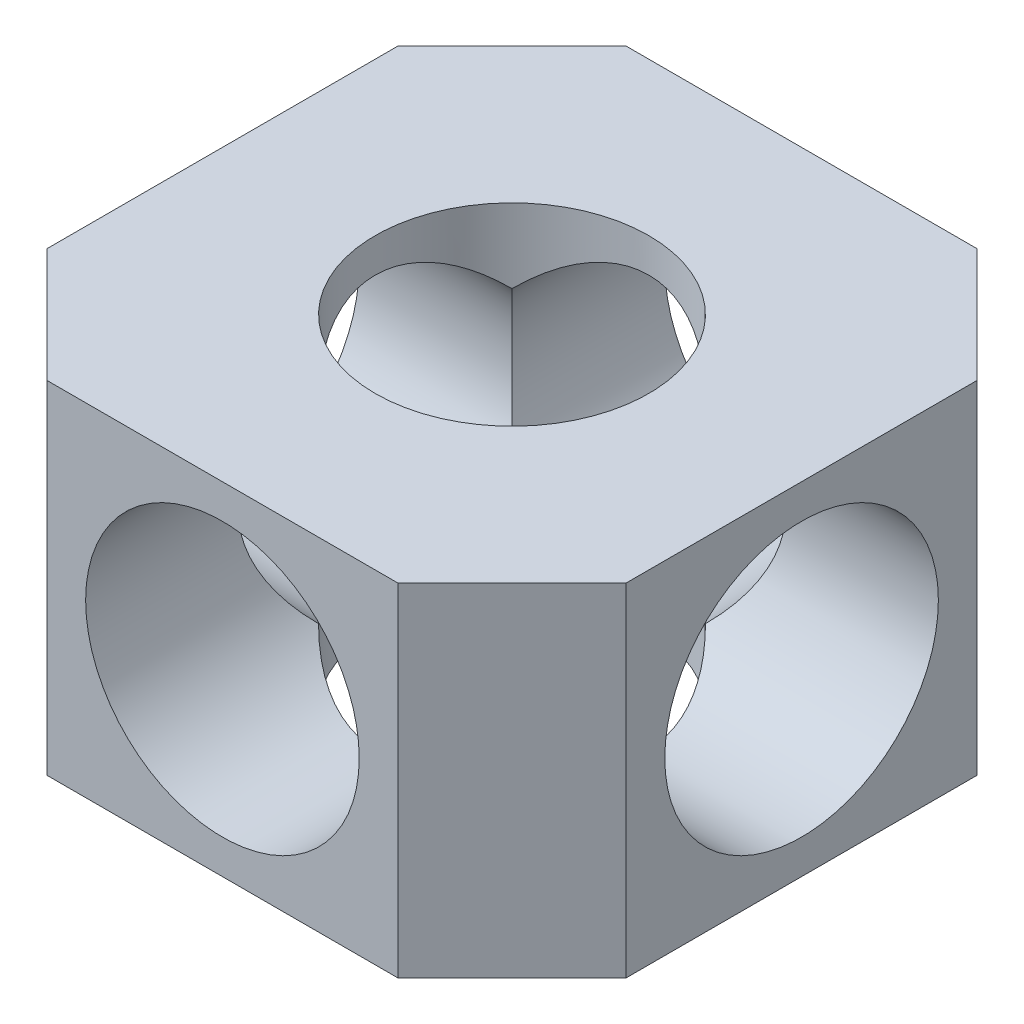
from build123d import *

# Parameters (mm, degrees)
SKETCH2_W               = 25.4
SKETCH2_H               = 25.4
BOSS_EXTRUDE1_DEPTH     = 7.5
CHAMFER1_SIZE           = 5
SKETCH3_R               = 6
CUT_EXTRUDE1_DEPTH      = 24.400427347
CUT_EXTRUDE2_REACH      = 31.372
CUT_EXTRUDE2_END_RADIUS = 6
SKETCH4_R               = 6
CIRPATTERN1_COUNT       = 4


with BuildPart() as part:
    # Sketch2 → Boss-Extrude1 (new, symmetric)
    with BuildSketch(Plane(origin=(0, 0, 0), x_dir=(1, 0, 0), z_dir=(0, 1, 0))):
        Rectangle(SKETCH2_W, SKETCH2_H)
    extrude(amount=BOSS_EXTRUDE1_DEPTH, both=True)

    # Chamfer1
    chamfer1_edges = [part.edges().sort_by_distance(p)[0] for p in [
        (12.7, 0, 12.7),
        (-12.7, 0, 12.7),
        (-12.7, 0, -12.7),
        (12.7, 0, -12.7),
    ]]
    chamfer(chamfer1_edges, length=CHAMFER1_SIZE)

    # Sketch3 → Cut-Extrude1 (cut, through all)
    with BuildSketch(Plane(origin=(0, 7.5, 0), x_dir=(1, 0, 0), z_dir=(0, 1, 0))):
        with Locations(Location((0, 0, 0), (0, 0, 270))):
            Circle(SKETCH3_R)
    extrude(amount=-CUT_EXTRUDE1_DEPTH, mode=Mode.SUBTRACT)

    # Cut-Extrude2: up to this cylinder (the profile starts outside it)
    cut_extrude2_end = Plane(origin=(0, 0, 0), z_dir=(0, 1, 0)) * Cylinder(CUT_EXTRUDE2_END_RADIUS, 75.744, mode=Mode.PRIVATE)
    # Sketch4 → Cut-Extrude2 (cut, up to the surface)
    with BuildSketch(Plane.XY.offset(12.7), mode=Mode.PRIVATE) as cut_extrude2_sk1:
        Circle(SKETCH4_R)
    cut_extrude2_tool1 = extrude(cut_extrude2_sk1.sketch, amount=-CUT_EXTRUDE2_REACH, mode=Mode.PRIVATE) - cut_extrude2_end
    cut_extrude2 = cut_extrude2_tool1.solids().sort_by_distance((0, 0, 12.7))[0]
    add(cut_extrude2, mode=Mode.SUBTRACT)

    # CirPattern1: Cut-Extrude2 ×4 about axis
    cirpattern1_axis = Axis((0, 7.5, 0), (0, 1, 0))
    for i in range(1, CIRPATTERN1_COUNT):
        add(cut_extrude2.rotate(cirpattern1_axis, i * 360 / CIRPATTERN1_COUNT), mode=Mode.SUBTRACT)


solid = part.part
